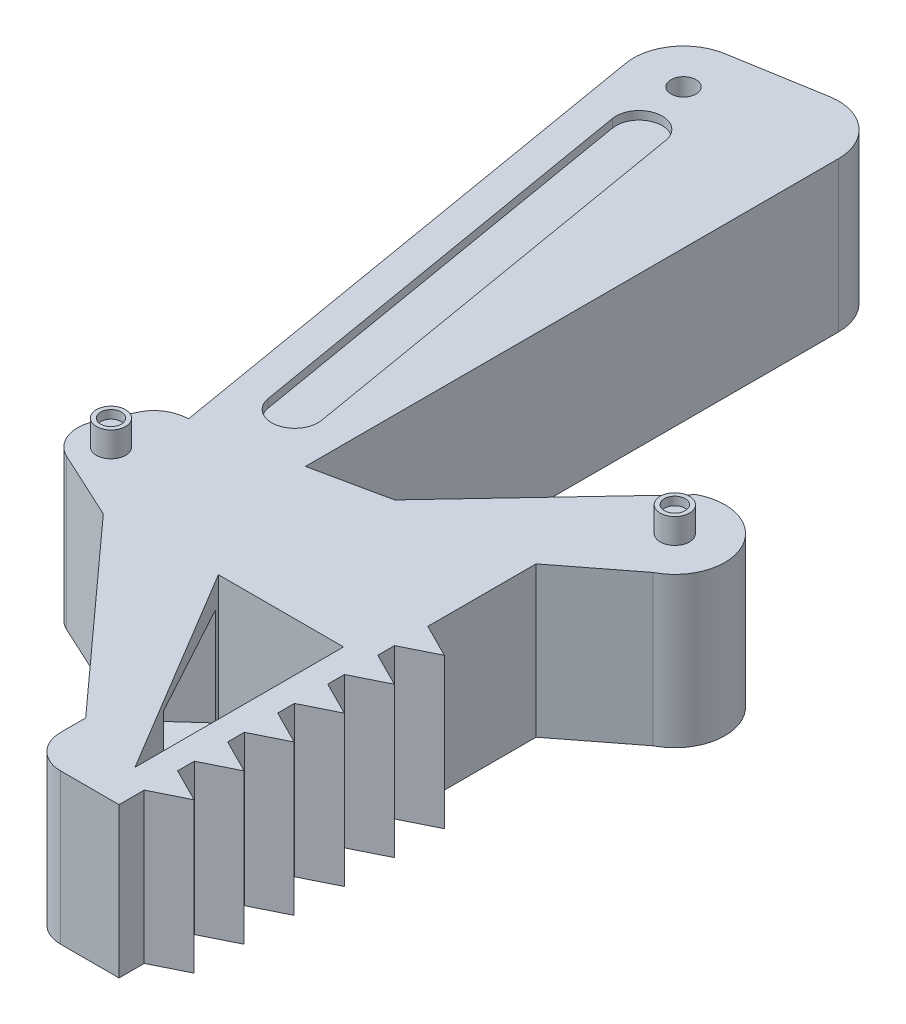
from build123d import *

# Parameters (mm, degrees)
BOSS_EXTRUDE1_DEPTH = 9
FILLET1_R           = 6
FILLET2_R           = 4
BOSS_EXTRUDE2_DEPTH = 18
LPATTERN1_COUNT     = 6
LPATTERN1_PITCH     = 6
CUT_EXTRUDE1_DEPTH  = 26
CUT_EXTRUDE3_DEPTH  = 10
SKETCH5_R           = 1.5
CUT_EXTRUDE4_DEPTH  = 124.909348227
SKETCH6_R           = 1.75
BOSS_EXTRUDE3_DEPTH = 3
SKETCH7_R           = 1.25
CUT_EXTRUDE6_DEPTH  = 1
SKETCH8_R           = 1.25
CUT_EXTRUDE7_DEPTH  = 1
CUT_EXTRUDE8_DEPTH  = 1


with BuildPart() as part:
    # Sketch1 → Boss-Extrude1 (new, symmetric)
    with BuildSketch(Plane(origin=(0, 0, 0), x_dir=(1, 0, 0), z_dir=(0, 1, 0))):
        with BuildLine():
            ThreePointArc((13.432245527, -50.487906924), (21.509028276, -53.088979862), (18.907955338, -61.165762611))
            Line((18.907955338, -61.165762611), (11, -67.286566673))
            Line((11, -67.286566673), (11, -117.286566673))
            Line((11, -117.286566673), (0, -117.286566673))
            Line((0, -117.286566673), (0, -110.286566673))
            Line((0, -110.286566673), (-20.129396013, -88.042299634))
            Line((-20.129396013, -88.042299634), (-31.928362438, -82.58479184))
            Line((-31.928362438, -82.58479184), (-27.730279519, -73.508663821))
            Line((-27.730279519, -73.508663821), (-24.896421124, -73.027946621))
            Line((-24.896421124, -73.027946621), (-12.941547125, -71))
            Line((-12.941547125, -71), (-4.10711559, -69.126148868))
            Line((-4.10711559, -69.126148868), (13.432245527, -50.487906924))
        make_face()
        Polygon((-12.941547125, -71), (-24.896421124, -73.027946621), (-36.603518956, -4.013862114), (-12.941547125, 0), align=None)
    extrude(amount=BOSS_EXTRUDE1_DEPTH, both=True)

    # Fillet1
    fillet1_edges = [part.edges().sort_by_distance(p)[0] for p in [
        (-36.603518956, 0, 4.013862114),
        (-12.941547125, 0, 0),
    ]]
    fillet(fillet1_edges, radius=FILLET1_R)

    # Fillet2
    fillet2_edges = [part.edges().sort_by_distance(p)[0] for p in [
        (0, 0, 117.286566673),
        (-31.928362438, 0, 82.58479184),
        (-27.730279519, 0, 73.508663821),
    ]]
    fillet(fillet2_edges, radius=FILLET2_R)

    # Sketch2 → Boss-Extrude2 (add)
    with BuildSketch(Plane(origin=(0, 9, 0), x_dir=(1, 0, 0), z_dir=(0, 1, 0))):
        Polygon((15, -112.286566673), (11, -114.265571656), (11, -110.265571656), align=None)
    boss_extrude2 = extrude(amount=-BOSS_EXTRUDE2_DEPTH)

    # LPattern1: Boss-Extrude2 ×6
    with Locations(*[(0, 0, -i * LPATTERN1_PITCH) for i in range(1, LPATTERN1_COUNT)]):
        add(boss_extrude2)

    # Sketch3 → Cut-Extrude1 (cut)
    with BuildSketch(Plane(origin=(0, 9, 0), x_dir=(1, 0, 0), z_dir=(0, 1, 0))):
        Polygon((8.082911966, -112.457569416), (8.082911966, -87.457569416), (-6.917088034, -87.457569416), align=None)
    extrude(amount=-CUT_EXTRUDE1_DEPTH, mode=Mode.SUBTRACT)

    # Sketch4 → Cut-Extrude3 (cut)
    with BuildSketch(Plane(origin=(-54.869240858, 0, 49.65255435), x_dir=(0.6709798671072843, 0, 0.7414755679971466), z_dir=(-0.7414755679971466, 0, 0.6709798671072843))):
        Polygon((60.774794667, 6), (60.774794667, -6), (78.951118156, -8.019187605), (78.951118156, 8.019187605), align=None)
    extrude(amount=-CUT_EXTRUDE3_DEPTH, mode=Mode.SUBTRACT)

    # Sketch5 → Cut-Extrude4 (cut, through all)
    with BuildSketch(Plane(origin=(0, 9, 0), x_dir=(1, 0, 0), z_dir=(0, 1, 0))):
        with Locations(Location((-29.68456047, -8.925889543, 0), (0, 0, 270))):
            Circle(SKETCH5_R)
    extrude(amount=-CUT_EXTRUDE4_DEPTH, mode=Mode.SUBTRACT)

    # Sketch6 → Boss-Extrude3 (add)
    with BuildSketch(Plane(origin=(0, 9, 0), x_dir=(1, 0, 0), z_dir=(0, 1, 0))):
        with Locations(Location((-26.618678063, -80.6335738, 0), (0, 0, 270))):
            Circle(SKETCH6_R)
        with Locations(Location((16.170100432, -55.826834767, 0), (0, 0, 270))):
            Circle(SKETCH6_R)
    boss_extrude3 = extrude(amount=BOSS_EXTRUDE3_DEPTH)

    # Sketch7 → Cut-Extrude6 (cut)
    with BuildSketch(Plane(origin=(0, 12, 0), x_dir=(1, 0, 0), z_dir=(0, 1, 0))):
        with Locations(Location((-26.618678063, -80.6335738, 0), (0, 0, 270))):
            Circle(SKETCH7_R)
    extrude(amount=-CUT_EXTRUDE6_DEPTH, mode=Mode.SUBTRACT)

    # Sketch8 → Cut-Extrude7 (cut)
    with BuildSketch(Plane(origin=(0, 12, 0), x_dir=(1, 0, 0), z_dir=(0, 1, 0))):
        with Locations(Location((16.170100432, -55.826834767, 0), (0, 0, 270))):
            Circle(SKETCH8_R)
    extrude(amount=-CUT_EXTRUDE7_DEPTH, mode=Mode.SUBTRACT)

    # Sketch9 → Cut-Extrude8 (cut)
    with BuildSketch(Plane(origin=(0, 9, 0), x_dir=(1, 0, 0), z_dir=(0, 1, 0))):
        with BuildLine():
            Line((-25.196199852, -15.539852581), (-16.757464085, -65.251677823))
            ThreePointArc((-16.757464085, -65.251677823), (-19.027845143, -68.450467492), (-22.226634811, -66.180086434))
            Line((-22.226634811, -66.180086434), (-30.665370577, -16.468261192))
            ThreePointArc((-30.665370577, -16.468261192), (-28.39498952, -13.269471524), (-25.196199852, -15.539852581))
        make_face()
    cut_extrude8 = extrude(amount=-CUT_EXTRUDE8_DEPTH, mode=Mode.SUBTRACT)

    # Mirror1: Boss-Extrude3, Cut-Extrude8 across plane
    add(boss_extrude3.mirror(Plane.ZX))
    add(cut_extrude8.mirror(Plane.ZX), mode=Mode.SUBTRACT)


solid = part.part
